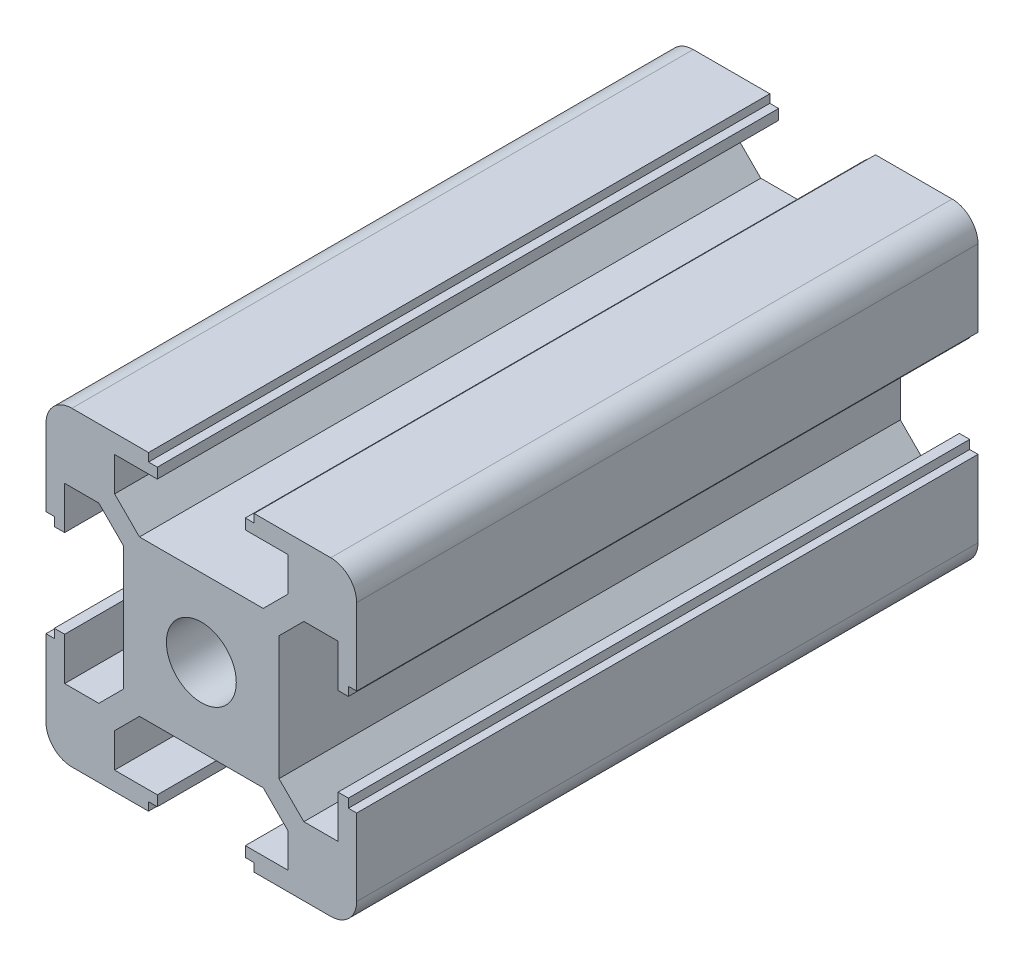
from build123d import *

# Parameters (mm, degrees)
SKETCH1_W                = 30
SKETCH1_H                = 30
BOSS_EXTRUDE1_DEPTH      = 30
SKETCH2_R                = 3.375
CUT_EXTRUDE1_DEPTH       = 64.639610307
FILLET1_R                = 2.5
CUT_EXTRUDE2_DEPTH       = 64.639610307
CIRPATTERN1_COUNT        = 4
CIRPATTERN1_COPY_1_DEPTH = 64.639610307
CIRPATTERN1_COPY_2_DEPTH = 64.639610307
CIRPATTERN1_COPY_3_DEPTH = 64.639610307


with BuildPart() as part:
    # Sketch1 → Boss-Extrude1 (new, symmetric)
    with BuildSketch(Plane.XY):
        Rectangle(SKETCH1_W, SKETCH1_H)
    extrude(amount=BOSS_EXTRUDE1_DEPTH, both=True)

    # Sketch2 → Cut-Extrude1 (cut, through all)
    with BuildSketch(Plane.XY.offset(30)):
        Circle(SKETCH2_R)
    extrude(amount=-CUT_EXTRUDE1_DEPTH, mode=Mode.SUBTRACT)

    # Fillet1
    fillet1_edges = [part.edges().sort_by_distance(p)[0] for p in [
        (15, -15, 0),
        (-15, -15, 0),
        (-15, 15, 0),
        (15, 15, 0),
    ]]
    fillet(fillet1_edges, radius=FILLET1_R)

    # Sketch3 → Cut-Extrude2 (cut, through all)
    with BuildSketch(Plane.XY.offset(30)):
        Polygon((0, 15), (-5.1, 15), (-5.1, 14.2), (-4.25, 14.2), (-4.25, 13.2), (-8.375, 13.2), (-8.375, 9.9), (-5.975, 7.5), (0, 7.5), align=None)
    cut_extrude2 = extrude(amount=-CUT_EXTRUDE2_DEPTH, mode=Mode.SUBTRACT)

    # Mirror1: Cut-Extrude2 across plane
    add(cut_extrude2.mirror(Plane(origin=(0, 0, 0), x_dir=(0, 0, 1), z_dir=(1, 0, 0))), mode=Mode.SUBTRACT)

    # CirPattern1: Cut-Extrude2 ×4 about axis
    cirpattern1_axis = Axis((0, 0, 0), (0, 0, 1))
    for i in range(1, CIRPATTERN1_COUNT):
        add(cut_extrude2.rotate(cirpattern1_axis, i * 360 / CIRPATTERN1_COUNT), mode=Mode.SUBTRACT)

    # CirPattern1 copy 1 sketch → CirPattern1 copy 1 (cut, through all)
    with BuildSketch(Plane(origin=(0, 0, 30), x_dir=(0, -1, 0), z_dir=(0, 0, 1))):
        Polygon((0, -15), (-5.1, -15), (-5.1, -14.2), (-4.25, -14.2), (-4.25, -13.2), (-8.375, -13.2), (-8.375, -9.9), (-5.975, -7.5), (0, -7.5), align=None)
    extrude(amount=-CIRPATTERN1_COPY_1_DEPTH, mode=Mode.SUBTRACT)

    # CirPattern1 copy 2 sketch → CirPattern1 copy 2 (cut, through all)
    with BuildSketch(Plane.XY.offset(30)):
        Polygon((0, -15), (-5.1, -15), (-5.1, -14.2), (-4.25, -14.2), (-4.25, -13.2), (-8.375, -13.2), (-8.375, -9.9), (-5.975, -7.5), (0, -7.5), align=None)
    extrude(amount=-CIRPATTERN1_COPY_2_DEPTH, mode=Mode.SUBTRACT)

    # CirPattern1 copy 3 sketch → CirPattern1 copy 3 (cut, through all)
    with BuildSketch(Plane(origin=(0, 0, 30), x_dir=(0, 1, 0), z_dir=(0, 0, 1))):
        Polygon((0, -15), (-5.1, -15), (-5.1, -14.2), (-4.25, -14.2), (-4.25, -13.2), (-8.375, -13.2), (-8.375, -9.9), (-5.975, -7.5), (0, -7.5), align=None)
    extrude(amount=-CIRPATTERN1_COPY_3_DEPTH, mode=Mode.SUBTRACT)


solid = part.part
